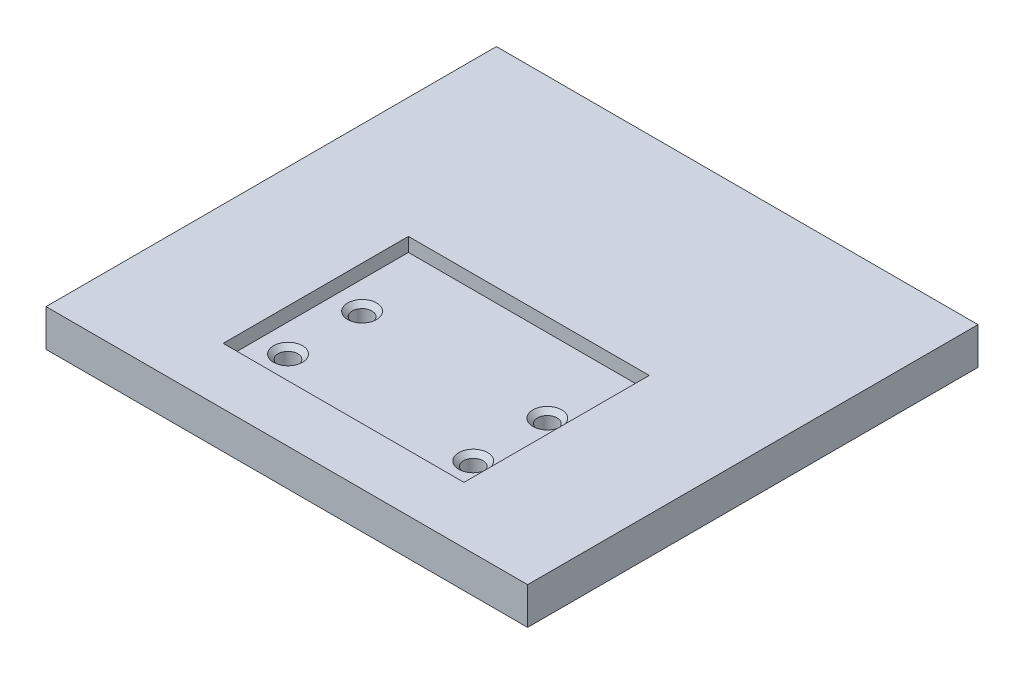
from build123d import *

# Parameters (mm, degrees)
SKETCH1_W            = 52
SKETCH1_H            = 40
SKETCH1_R            = 2.75
BOSS_EXTRUDE10_DEPTH = 5
SKETCH1_21_R         = 2.75
BOSS_EXTRUDE13_DEPTH = 5
SKETCH1_22_R         = 2.12
CUT_EXTRUDE4_DEPTH   = 7
CHAMFER1_SIZE        = 1
SKETCH1_23_R         = 2.75
BOSS_EXTRUDE14_DEPTH = 5
SKETCH1_24_R         = 2.12
CUT_EXTRUDE6_DEPTH   = 5
SKETCH1_25_R         = 2.75
BOSS_EXTRUDE15_DEPTH = 5
SKETCH1_26_R         = 2.12
CUT_EXTRUDE7_DEPTH   = 18
SKETCH1_29_R         = 2.75
BOSS_EXTRUDE17_DEPTH = 5
SKETCH1_30_R         = 2.12
CUT_EXTRUDE9_DEPTH   = 14
CHAMFER3_SIZE        = 1
CHAMFER4_SIZE        = 1
CHAMFER5_SIZE        = 1
SKETCH5_W            = 104
SKETCH5_H            = 97.258090947
BOSS_EXTRUDE19_DEPTH = 8


with BuildPart() as part:
    # Sketch1 → Boss-Extrude10 (new body)
    with BuildSketch(Plane(origin=(0, 0, 0), x_dir=(1, 0, 0), z_dir=(0, 1, 0))):
        Rectangle(SKETCH1_W, SKETCH1_H)
        with Locations((-20, -12)):
            Circle(SKETCH1_R, mode=Mode.SUBTRACT)
        with Locations((20, -12)):
            Circle(SKETCH1_R, mode=Mode.SUBTRACT)
        with Locations((-20, 4)):
            Circle(SKETCH1_R, mode=Mode.SUBTRACT)
        with Locations((20, 4)):
            Circle(SKETCH1_R, mode=Mode.SUBTRACT)
    extrude(amount=BOSS_EXTRUDE10_DEPTH)

    # Sketch1<21> → Boss-Extrude13 (add)
    with BuildSketch(Plane(origin=(0, 0, 0), x_dir=(1, 0, 0), z_dir=(0, 1, 0))):
        with Locations((20, 4)):
            Circle(SKETCH1_21_R)
    extrude(amount=BOSS_EXTRUDE13_DEPTH)

    # Sketch1<22> → Cut-Extrude4 (cut)
    with BuildSketch(Plane(origin=(0, 0, 0), x_dir=(1, 0, 0), z_dir=(0, 1, 0))):
        with Locations((20, 4)):
            Circle(SKETCH1_22_R)
    extrude(amount=CUT_EXTRUDE4_DEPTH, mode=Mode.SUBTRACT)

    # Chamfer1
    chamfer1_edges = [part.edges().sort_by_distance(p)[0] for p in [
        (17.88, 5, -4),
    ]]
    chamfer(chamfer1_edges, length=CHAMFER1_SIZE)

    # Sketch1<23> → Boss-Extrude14 (add)
    with BuildSketch(Plane(origin=(0, 0, 0), x_dir=(1, 0, 0), z_dir=(0, 1, 0))):
        with Locations((20, -12)):
            Circle(SKETCH1_23_R)
    extrude(amount=BOSS_EXTRUDE14_DEPTH)

    # Sketch1<24> → Cut-Extrude6 (cut)
    with BuildSketch(Plane(origin=(0, 0, 0), x_dir=(1, 0, 0), z_dir=(0, 1, 0))):
        with Locations((20, -12)):
            Circle(SKETCH1_24_R)
    extrude(amount=CUT_EXTRUDE6_DEPTH, mode=Mode.SUBTRACT)

    # Sketch1<25> → Boss-Extrude15 (add)
    with BuildSketch(Plane(origin=(0, 0, 0), x_dir=(1, 0, 0), z_dir=(0, 1, 0))):
        with Locations((-20, -12)):
            Circle(SKETCH1_25_R)
    extrude(amount=BOSS_EXTRUDE15_DEPTH)

    # Sketch1<26> → Cut-Extrude7 (cut)
    with BuildSketch(Plane(origin=(0, 0, 0), x_dir=(1, 0, 0), z_dir=(0, 1, 0))):
        with Locations((-20, -12)):
            Circle(SKETCH1_26_R)
    extrude(amount=CUT_EXTRUDE7_DEPTH, mode=Mode.SUBTRACT)

    # Sketch1<29> → Boss-Extrude17 (add)
    with BuildSketch(Plane(origin=(0, 0, 0), x_dir=(1, 0, 0), z_dir=(0, 1, 0))):
        with Locations((-20, 4)):
            Circle(SKETCH1_29_R)
    extrude(amount=BOSS_EXTRUDE17_DEPTH)

    # Sketch1<30> → Cut-Extrude9 (cut)
    with BuildSketch(Plane(origin=(0, 0, 0), x_dir=(1, 0, 0), z_dir=(0, 1, 0))):
        with Locations((-20, 4)):
            Circle(SKETCH1_30_R)
    extrude(amount=CUT_EXTRUDE9_DEPTH, mode=Mode.SUBTRACT)

    # Chamfer3
    chamfer3_edges = [part.edges().sort_by_distance(p)[0] for p in [
        (-22.12, 5, -4),
    ]]
    chamfer(chamfer3_edges, length=CHAMFER3_SIZE)

    # Chamfer4
    chamfer4_edges = [part.edges().sort_by_distance(p)[0] for p in [
        (-22.12, 5, 12),
    ]]
    chamfer(chamfer4_edges, length=CHAMFER4_SIZE)

    # Chamfer5
    chamfer5_edges = [part.edges().sort_by_distance(p)[0] for p in [
        (17.88, 5, 12),
    ]]
    chamfer(chamfer5_edges, length=CHAMFER5_SIZE)

    # Sketch5 → Boss-Extrude19 (add)
    with BuildSketch(Plane(origin=(0, 0, 0), x_dir=(1, 0, 0), z_dir=(0, 1, 0))):
        with Locations((0, 16.370954527)):
            Rectangle(SKETCH5_W, SKETCH5_H)
        Polygon((26, -20), (-26, -20), (-26, 20), (0, 20), (26, 20), align=None, mode=Mode.SUBTRACT)
    extrude(amount=BOSS_EXTRUDE19_DEPTH)


solid = part.part
